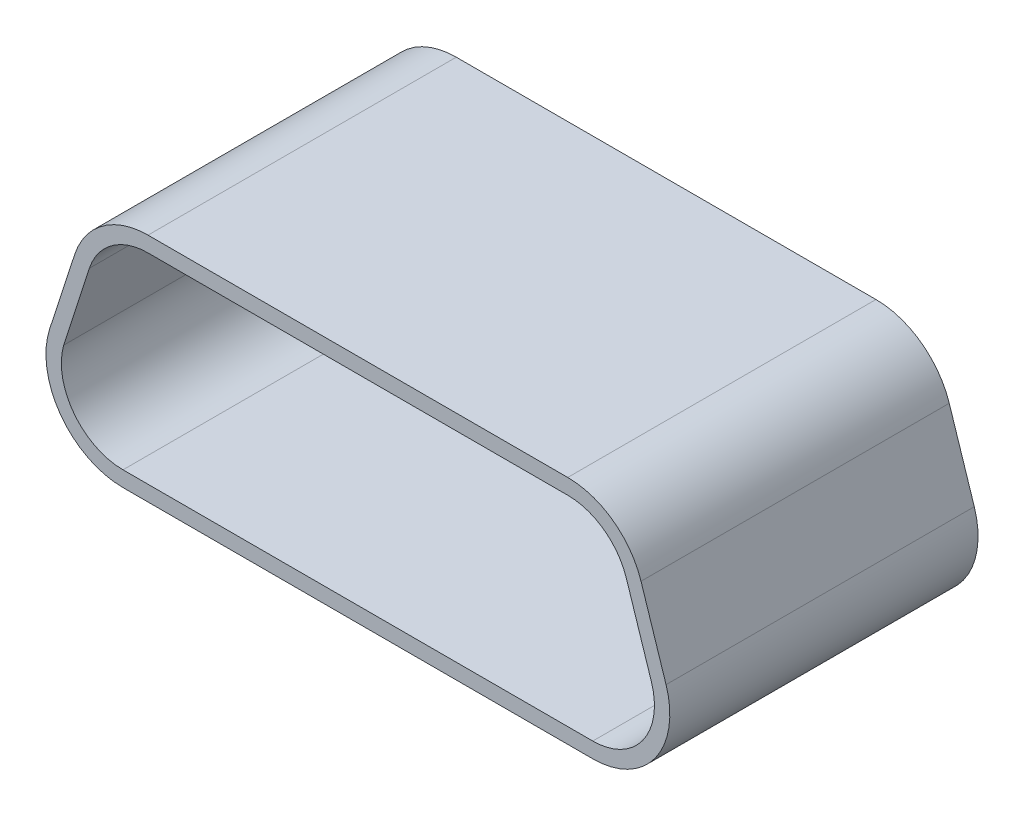
from build123d import *

# Parameters (mm, degrees)
DODANIE_WYCI_GNI_CIE1_DEPTH = 20
ZAOKR_GLENIE2_R             = 5
WYTNIJ_WYCI_GNI_CIE1_DEPTH  = 43.884482968


with BuildPart() as part:
    # Szkic1 → Dodanie-wyciągnięcie1 (new body)
    with BuildSketch(Plane.XY):
        Polygon((-7.521041545, 0), (36.725544307, 0), (35.100945826, 5), (31.851748863, 15), (-2.647246102, 15), (-5.896443064, 5), align=None)
    extrude(amount=DODANIE_WYCI_GNI_CIE1_DEPTH)

    # Zaokrąglenie2
    zaokr_glenie2_edges = [part.edges().sort_by_distance(p)[0] for p in [
        (36.725544307, 0, 10),
        (-7.521041545, 0, 10),
        (-2.647246102, 15, 10),
        (31.851748863, 15, 10),
    ]]
    fillet(zaokr_glenie2_edges, radius=ZAOKR_GLENIE2_R)

    # Szkic2 → Wytnij-wyciągnięcie1 (cut, through all)
    with BuildSketch(Plane.XY.offset(20)):
        with BuildLine():
            Line((28.219036223, 14), (0.985466538, 14))
            ThreePointArc((0.985466538, 14), (-1.365674471, 13.236067977), (-2.818759527, 11.236067977))
            Line((-2.818759527, 11.236067977), (-2.820363357, 11.231120957))
            Line((-2.820363357, 11.231120957), (-4.491898112, 6.075264084))
            ThreePointArc((-4.491898112, 6.075264084), (-3.825121298, 2.581431863), (-0.639131943, 1))
            Line((-0.639131943, 1), (29.843634705, 1))
            ThreePointArc((29.843634705, 1), (33.079702682, 2.648858991), (33.64786077, 6.236067977))
            Line((33.64786077, 6.236067977), (32.023262289, 11.236067977))
            ThreePointArc((32.023262289, 11.236067977), (30.570177233, 13.236067977), (28.219036223, 14))
        make_face()
    extrude(amount=-WYTNIJ_WYCI_GNI_CIE1_DEPTH, mode=Mode.SUBTRACT)


solid = part.part
